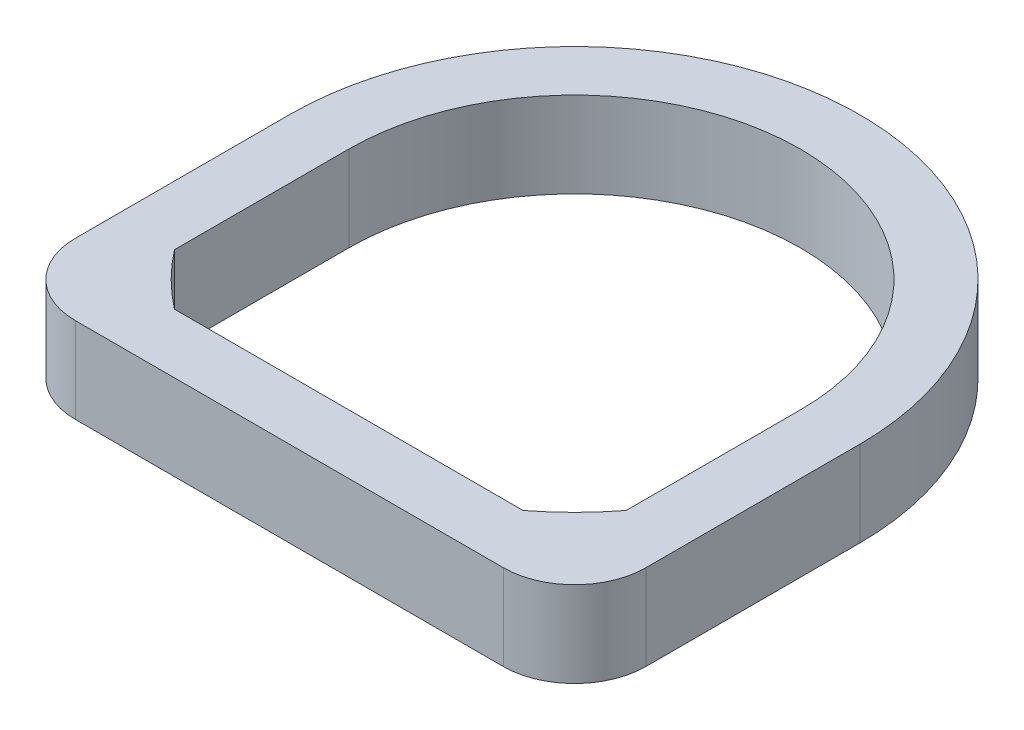
from build123d import *

# Parameters (mm, degrees)
BOSS_EXTRUDE1_DEPTH = 3
FILLET1_R           = 2.5


with BuildPart() as part:
    # Sketch1 → Boss-Extrude1 (new body)
    with BuildSketch(Plane(origin=(0, 0, 0), x_dir=(1, 0, 0), z_dir=(0, 1, 0))):
        with BuildLine():
            Line((-10, 0), (-7.916454192, 0))
            ThreePointArc((-7.916454192, 0), (0, 7.916454192), (7.916454192, 0))
            Line((7.916454192, 0), (10, 0))
            ThreePointArc((10, 0), (0, 10), (-10, 0))
        make_face()
        with BuildLine():
            Line((-7.916454192, -5.916454192), (-7.916454192, 0))
            Line((-7.916454192, 0), (-10, 0))
            ThreePointArc((-10, 0), (-9.464791121, -3.2276507), (-7.916454192, -6.109807936))
            Line((-7.916454192, -6.109807936), (-7.916454192, -5.916454192))
        make_face()
        with BuildLine():
            ThreePointArc((-7.916454192, -6.109807936), (-9.464791121, -3.2276507), (-10, 0))
            Line((-10, 0), (-10, -10))
            Line((-10, -10), (0, -10))
            ThreePointArc((0, -10), (-3.2276507, -9.464791121), (-6.109807936, -7.916454192))
            Line((-6.109807936, -7.916454192), (-7.916454192, -7.916454192))
            Line((-7.916454192, -7.916454192), (-7.916454192, -6.109807936))
        make_face()
        with BuildLine():
            Line((5.916454192, -7.916454192), (0, -7.916454192))
            Line((0, -7.916454192), (-5.916454192, -7.916454192))
            Line((-5.916454192, -7.916454192), (-6.109807936, -7.916454192))
            ThreePointArc((-6.109807936, -7.916454192), (-3.2276507, -9.464791121), (0, -10))
            ThreePointArc((0, -10), (3.2276507, -9.464791121), (6.109807936, -7.916454192))
            Line((6.109807936, -7.916454192), (5.916454192, -7.916454192))
        make_face()
        with BuildLine():
            Line((10, -10), (10, 0))
            ThreePointArc((10, 0), (9.464791121, -3.2276507), (7.916454192, -6.109807936))
            Line((7.916454192, -6.109807936), (7.916454192, -7.916454192))
            Line((7.916454192, -7.916454192), (6.109807936, -7.916454192))
            ThreePointArc((6.109807936, -7.916454192), (3.2276507, -9.464791121), (0, -10))
            Line((0, -10), (10, -10))
        make_face()
        with BuildLine():
            Line((10, 0), (7.916454192, 0))
            Line((7.916454192, 0), (7.916454192, -5.916454192))
            Line((7.916454192, -5.916454192), (7.916454192, -6.109807936))
            ThreePointArc((7.916454192, -6.109807936), (9.464791121, -3.2276507), (10, 0))
        make_face()
        with BuildLine():
            Line((7.916454192, -7.916454192), (7.916454192, -6.109807936))
            ThreePointArc((7.916454192, -6.109807936), (7.071067812, -7.071067812), (6.109807936, -7.916454192))
            Line((6.109807936, -7.916454192), (7.916454192, -7.916454192))
        make_face()
        with BuildLine():
            ThreePointArc((-6.109807936, -7.916454192), (-7.071067812, -7.071067812), (-7.916454192, -6.109807936))
            Line((-7.916454192, -6.109807936), (-7.916454192, -7.916454192))
            Line((-7.916454192, -7.916454192), (-6.109807936, -7.916454192))
        make_face()
    extrude(amount=BOSS_EXTRUDE1_DEPTH)

    # Fillet1
    fillet1_edges = [part.edges().sort_by_distance(p)[0] for p in [
        (-10, 1.5, 10),
        (10, 1.5, 10),
    ]]
    fillet(fillet1_edges, radius=FILLET1_R)


solid = part.part
